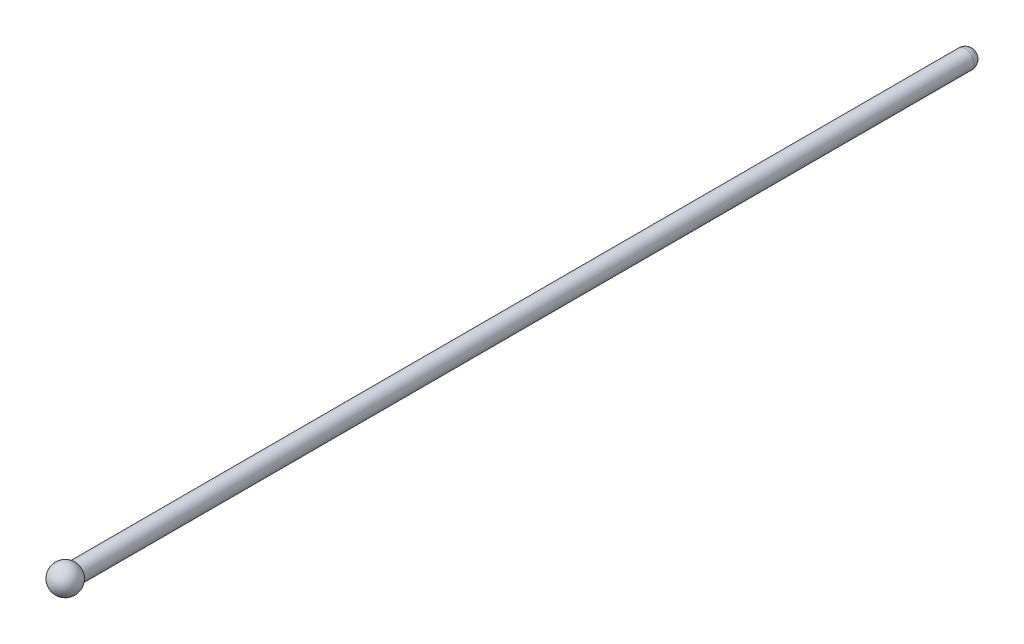
from build123d import *

# Parameters (mm, degrees)
SKETCH1_R           = 0.5
BOSS_EXTRUDE1_DEPTH = 50
FILLET2_R           = 0.5


with BuildPart() as part:
    # Sketch1 → Boss-Extrude1 (new body)
    with BuildSketch(Plane.XY):
        Circle(SKETCH1_R)
    extrude(amount=BOSS_EXTRUDE1_DEPTH)

    # Sketch3 → Revolve1 (revolve)
    with BuildSketch(Plane.XY.offset(50)):
        with BuildLine():
            Line((-0.75, 0), (0.75, 0))
            ThreePointArc((0.75, 0), (0, 0.75), (-0.75, 0))
        make_face()
    revolve(axis=Axis((-0.75, 0, 50), (1, 0, 0)))

    # Fillet2
    fillet2_edges = [part.edges().sort_by_distance(p)[0] for p in [
        (-0.5, 0, 0),
    ]]
    fillet(fillet2_edges, radius=FILLET2_R)


solid = part.part
